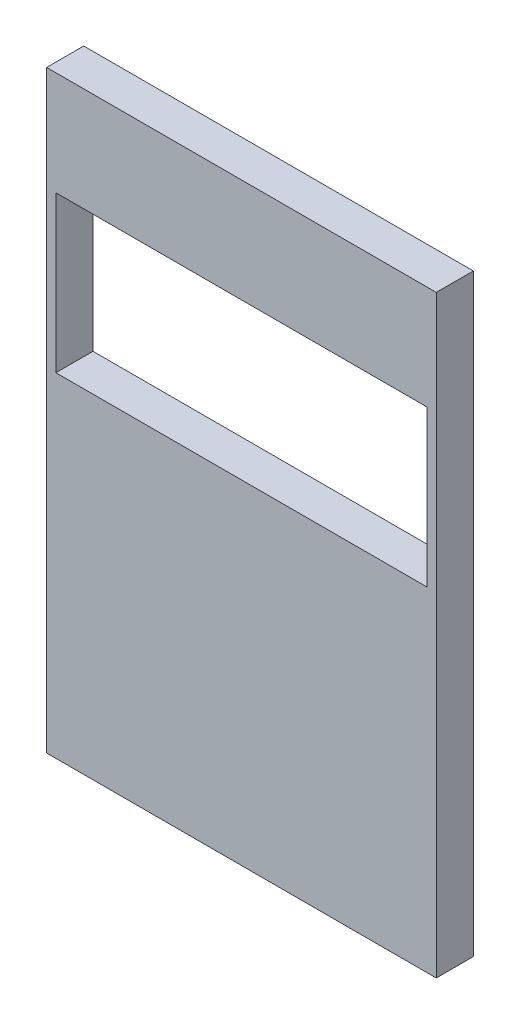
from build123d import *

# Parameters (mm, degrees)
SKETCH1_W           = 105
SKETCH1_H           = 160
BOSS_EXTRUDE1_DEPTH = 10
SKETCH3_W           = 100
SKETCH3_H           = 42
CUT_EXTRUDE1_DEPTH  = 97.209407024


with BuildPart() as part:
    # Sketch1 → Boss-Extrude1 (new body)
    with BuildSketch(Plane.XY):
        Rectangle(SKETCH1_W, SKETCH1_H)
    extrude(amount=BOSS_EXTRUDE1_DEPTH)

    # Sketch3 → Cut-Extrude1 (cut, through all)
    with BuildSketch(Plane(origin=(0, 0, 0), x_dir=(-1, 0, 0), z_dir=(0, 0, -1))):
        with Locations((0, 31)):
            Rectangle(SKETCH3_W, SKETCH3_H)
    extrude(amount=-CUT_EXTRUDE1_DEPTH, mode=Mode.SUBTRACT)


solid = part.part
